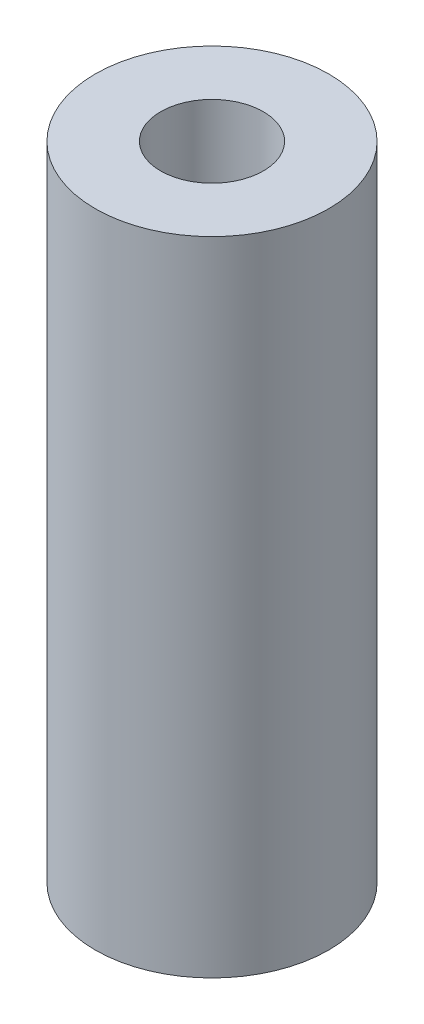
from build123d import *

# Parameters (mm, degrees)
SKETCH1_R           = 6.35
SKETCH1_R_2         = 2.794
BOSS_EXTRUDE1_DEPTH = 34.925


with BuildPart() as part:
    # Sketch1 → Boss-Extrude1 (new body)
    with BuildSketch(Plane(origin=(0, 0, 0), x_dir=(1, 0, 0), z_dir=(0, 1, 0))):
        with Locations(Location((0, 0, 0), (0, 0, 270))):
            Circle(SKETCH1_R)
        with Locations(Location((0, 0, 0), (0, 0, 270))):
            Circle(SKETCH1_R_2, mode=Mode.SUBTRACT)
    extrude(amount=BOSS_EXTRUDE1_DEPTH)


solid = part.part
